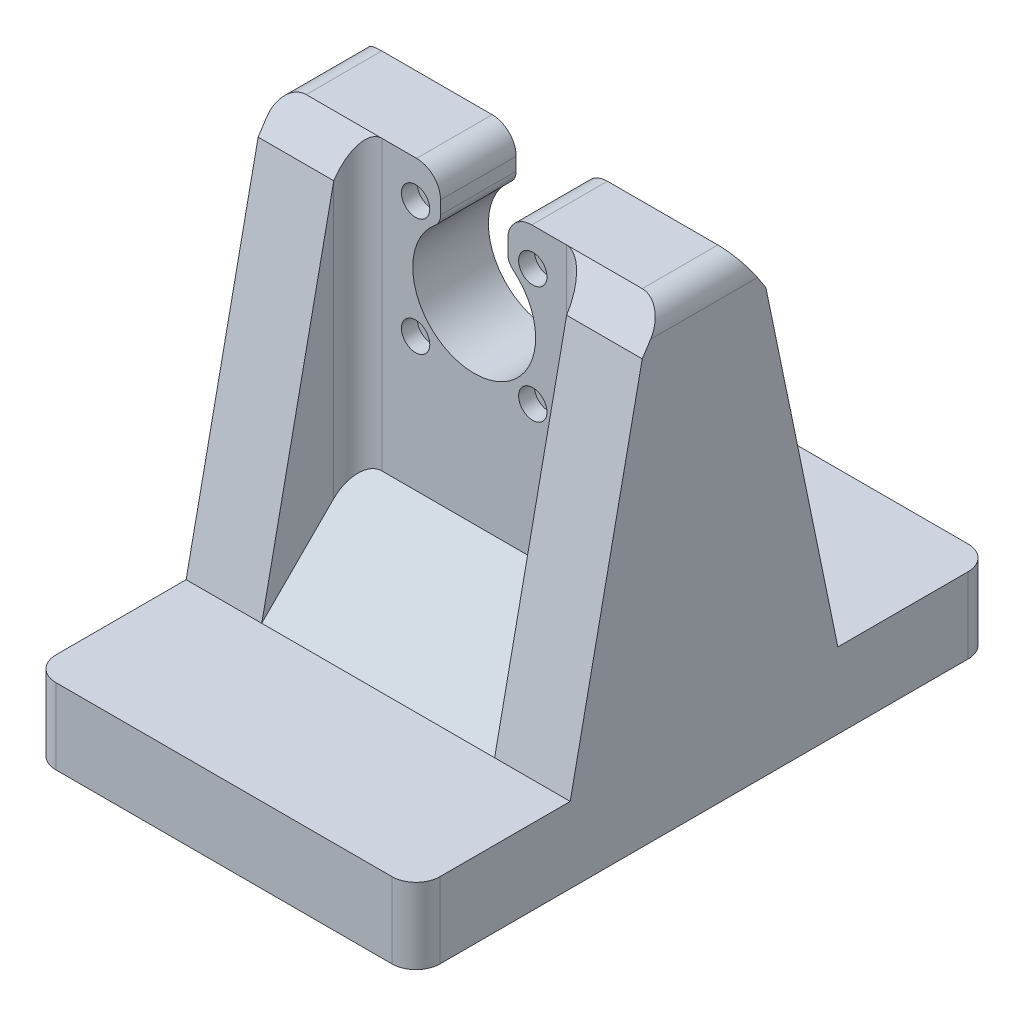
from build123d import *

# Parameters (mm, degrees)
BOSS_EXTRUDE1_DEPTH = 20
SKETCH2_R           = 16.25
SKETCH2_R_2         = 2.15
CUT_EXTRUDE1_DEPTH  = 20
SKETCH5_R           = 3.75
CUT_EXTRUDE4_DEPTH  = 4.2
FILLET3_R           = 4
SKETCH6_W           = 101.6
SKETCH6_H           = 152.4
BOSS_EXTRUDE2_DEPTH = 20
SKETCH7_R           = 3.75
CUT_EXTRUDE5_DEPTH  = 4.2
SKETCH8_R           = 1.8
CUT_EXTRUDE6_DEPTH  = 60
CHAMFER1_SIZE       = 25.4
BOSS_EXTRUDE4_DEPTH = 20
FILLET4_R           = 6.35
CUT_EXTRUDE8_DEPTH  = 165.339404891
CUT_EXTRUDE9_DEPTH  = 165.339404891


with BuildPart() as part:
    # Sketch1 → Boss-Extrude1 (new body)
    with BuildSketch(Plane.XY):
        Polygon((50.8, 25.4), (8.89, 25.4), (8.89, 13.302928249), (-8.89, 13.302928249), (-8.89, 25.4), (-50.8, 25.4), (-50.8, -76.2), (50.8, -76.2), align=None)
    extrude(amount=BOSS_EXTRUDE1_DEPTH)

    # Sketch2 → Cut-Extrude1 (cut)
    with BuildSketch(Plane.XY.offset(20)):
        Circle(SKETCH2_R)
        with Locations((-15.5, -15.5)):
            Circle(SKETCH2_R_2)
        with Locations((-15.5, 15.5)):
            Circle(SKETCH2_R_2)
        with Locations((15.5, -15.5)):
            Circle(SKETCH2_R_2)
        with Locations((15.5, 15.5)):
            Circle(SKETCH2_R_2)
    extrude(amount=-CUT_EXTRUDE1_DEPTH, mode=Mode.SUBTRACT)

    # Sketch5 → Cut-Extrude4 (cut)
    with BuildSketch(Plane.XY.offset(20)):
        with Locations((-15.5, 15.5)):
            Circle(SKETCH5_R)
        with Locations((15.5, 15.5)):
            Circle(SKETCH5_R)
        with Locations((15.5, -15.5)):
            Circle(SKETCH5_R)
        with Locations((-15.5, -15.5)):
            Circle(SKETCH5_R)
    extrude(amount=-CUT_EXTRUDE4_DEPTH, mode=Mode.SUBTRACT)

    # Fillet3
    fillet3_edges = [part.edges().sort_by_distance(p)[0] for p in [
        (8.89, 13.602587989, 10),
        (-8.89, 13.602587989, 10),
    ]]
    fillet(fillet3_edges, radius=FILLET3_R)

    # Sketch6 → Boss-Extrude2 (add)
    with BuildSketch(Plane.XZ.offset(76.2)):
        with Locations((0, 10)):
            Rectangle(SKETCH6_W, SKETCH6_H)
    extrude(amount=BOSS_EXTRUDE2_DEPTH)

    # Sketch7 → Cut-Extrude5 (cut)
    with BuildSketch(Plane.XZ.offset(96.2)):
        with Locations((-38.1, 10)):
            Circle(SKETCH7_R)
        with Locations((38.1, 10)):
            Circle(SKETCH7_R)
        with Locations((0, 10)):
            Circle(SKETCH7_R)
    extrude(amount=-CUT_EXTRUDE5_DEPTH, mode=Mode.SUBTRACT)

    # Sketch8 → Cut-Extrude6 (cut)
    with BuildSketch(Plane.XZ.offset(92)):
        with Locations((-38.1, 10)):
            Circle(SKETCH8_R)
        with Locations((38.1, 10)):
            Circle(SKETCH8_R)
        with Locations((0, 10)):
            Circle(SKETCH8_R)
    extrude(amount=-CUT_EXTRUDE6_DEPTH, mode=Mode.SUBTRACT)

    # Chamfer1
    chamfer1_edges = [part.edges().sort_by_distance(p)[0] for p in [
        (0, -76.2, 0),
        (0, -76.2, 20),
    ]]
    chamfer(chamfer1_edges, length=CHAMFER1_SIZE)

    # Sketch12 → Boss-Extrude4 (add)
    with BuildSketch(Plane(origin=(50.8, 0, 0), x_dir=(0, 0, -1), z_dir=(1, 0, 0))):
        Polygon((-86.2, -76.2), (-20, 25.4), (-20, -76.2), align=None)
        Polygon((0, -76.2), (66.2, -76.2), (0, 25.4), align=None)
    boss_extrude4 = extrude(amount=-BOSS_EXTRUDE4_DEPTH)

    # Mirror2: Boss-Extrude4 across plane
    add(boss_extrude4.mirror(Plane(origin=(0, 0, 0), x_dir=(0, 0, 1), z_dir=(1, 0, 0))))

    # Fillet4
    fillet4_edges = [part.edges().sort_by_distance(p)[0] for p in [
        (50.8, -86.2, -66.2),
        (50.8, -86.2, 86.2),
        (-50.8, -86.2, 86.2),
        (-50.8, -86.2, -66.2),
        (-50.8, 25.4, 10),
        (-8.89, 25.4, 10),
        (8.89, 25.4, 10),
        (50.8, 25.4, 10),
        (30.8, -12.7, 20),
        (30.8, -12.7, 0),
        (-30.8, -12.7, 20),
        (-30.8, -12.7, 0),
    ]]
    fillet(fillet4_edges, radius=FILLET4_R)

    # Sketch16 → Cut-Extrude8 (cut, through all)
    with BuildSketch(Plane.ZY.offset(50.8)):
        Polygon((-66.2, -76.2), (-25.4, -76.2), (-6.35, 15.654380665), align=None)
    extrude(amount=-CUT_EXTRUDE8_DEPTH, mode=Mode.SUBTRACT)

    # Sketch14 → Cut-Extrude9 (cut, through all)
    with BuildSketch(Plane(origin=(50.8, 0, 0), x_dir=(0, 0, -1), z_dir=(1, 0, 0))):
        Polygon((-86.2, -76.2), (-26.35, 15.654380665), (-45.4, -76.2), align=None)
    extrude(amount=-CUT_EXTRUDE9_DEPTH, mode=Mode.SUBTRACT)


solid = part.part
